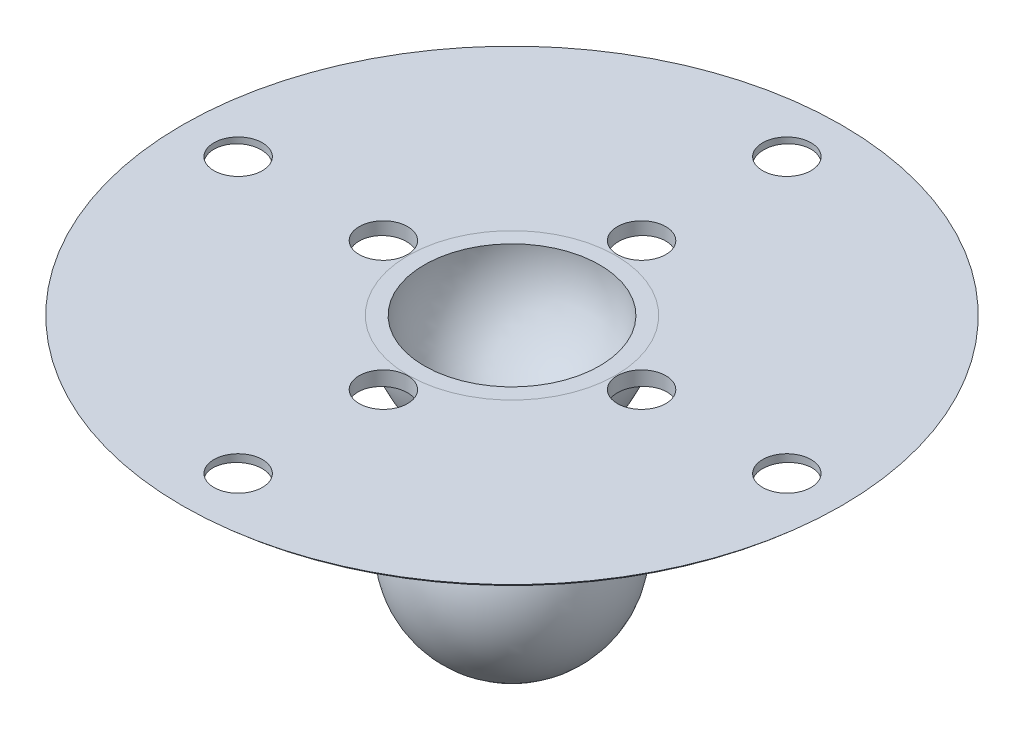
from build123d import *

# Parameters (mm, degrees)
SKETCH2_R          = 0.75
CUT_EXTRUDE1_DEPTH = 13


with BuildPart() as part:
    # Sketch1 → Revolve5 (revolve)
    with BuildSketch(Plane(origin=(0, 0, 0), x_dir=(0, 0, -1), z_dir=(1, 0, 0)), mode=Mode.PRIVATE) as revolve5_sk:
        with BuildLine():
            Line((3.200169079, 3.199999996), (10.200169079, 3.199999996))
            Line((10.200169079, 3.199999996), (10.042765879, 3.062162949))
            Line((10.042765879, 3.062162949), (3.166496343, 2.736997127))
            ThreePointArc((3.166496343, 2.736997127), (2.452607904, 1.144387238), (1.009204423, 0.163250471))
            Line((1.009204423, 0.163250471), (1.260482976, -0.27769215))
            ThreePointArc((1.260482976, -0.27769215), (2.929664053, -3.645407678), (-0.000108694, -5.999999999))
            Line((-0.000108694, -5.999999999), (4.9063e-05, -5.499999995))
            ThreePointArc((4.9063e-05, -5.499999995), (2.499911684, -2.999898287), (-0.00015436, -0.5))
            Line((-0.00015436, -0.5), (2.6419e-05, 0.499999999))
            ThreePointArc((2.6419e-05, 0.499999999), (1.90930695, 1.290761249), (2.700169079, 3.199999996))
            Line((2.700169079, 3.199999996), (3.200169079, 3.199999996))
        make_face()
    revolve(revolve5_sk.sketch.rotate(Axis((0, 10.3413497, 0.015216129), (0, -0.9999999999860412, 5.283725131868927e-06)), 180), axis=Axis((0, 10.3413497, 0.015216129), (0, -0.9999999999860412, 5.283725131868927e-06)))

    # Sketch2 → Cut-Extrude1 (cut)
    with BuildSketch(Plane(origin=(0, 3.20005389, -1.6908e-05), x_dir=(1, 0, 0), z_dir=(0, 0.9999999999860413, -5.283725131900164e-06))):
        with Locations(Location((0, 0, 0), (0, 0, 270))):
            Circle(SKETCH2_R)
        with Locations(Location((-4, 0, 0), (0, 0, 135.216084853))):
            Circle(SKETCH2_R)
        with Locations(Location((-8.5, 0, 0), (0, 0, 179.897064735))):
            Circle(SKETCH2_R)
        with Locations(Location((0, -4, 0), (0, 0, 89.999999984))):
            Circle(SKETCH2_R)
        with Locations(Location((0, -8.5, 0), (0, 0, 270))):
            Circle(SKETCH2_R)
        with Locations(Location((0, 8.5, 0), (0, 0, 135.275892863))):
            Circle(SKETCH2_R)
        with Locations(Location((0, 4, 0), (0, 0, 135.000437105))):
            Circle(SKETCH2_R)
        with Locations(Location((8.5, 0, 0), (0, 0, 0.102935265))):
            Circle(SKETCH2_R)
        with Locations(Location((4, 0, 0), (0, 0, 135.000437102))):
            Circle(SKETCH2_R)
    extrude(amount=-CUT_EXTRUDE1_DEPTH, mode=Mode.SUBTRACT)


solid = part.part
